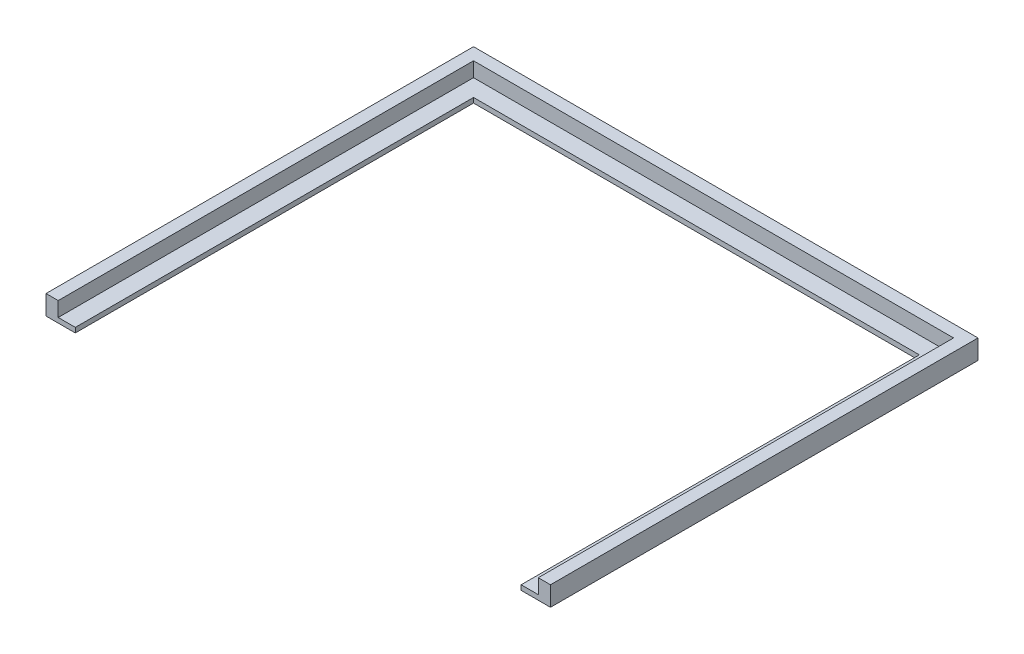
from build123d import *

# Parameters (mm, degrees)
SKETCH1_W               = 206.5
SKETCH1_H               = 350
SKETCH1_W_2             = 182.5
SKETCH1_H_2             = 326
BOSS_EXTRUDE1_DEPTH     = 2
SKETCH2_W               = 206.5
SKETCH2_H               = 350
SKETCH2_W_2             = 196.5
SKETCH2_H_2             = 340
BOSS_EXTRUDE2_DEPTH     = 6
CUT_EXTRUDE3_DEPTH      = 204.345918326
CUT_EXTRUDE3_DEPTH_BACK = 204.345918326
SKETCH3_W               = 400
SKETCH3_H               = 400


with BuildPart() as part:
    # Sketch1 → Boss-Extrude1 (new body)
    with BuildSketch(Plane(origin=(0, 0, 0), x_dir=(1, 0, 0), z_dir=(0, 1, 0))):
        Rectangle(SKETCH1_W, SKETCH1_H)
        Rectangle(SKETCH1_W_2, SKETCH1_H_2, mode=Mode.SUBTRACT)
    extrude(amount=BOSS_EXTRUDE1_DEPTH)

    # Sketch2 → Boss-Extrude2 (add)
    with BuildSketch(Plane(origin=(0, 2, 0), x_dir=(1, 0, 0), z_dir=(0, 1, 0))):
        Rectangle(SKETCH2_W, SKETCH2_H)
        Rectangle(SKETCH2_W_2, SKETCH2_H_2, mode=Mode.SUBTRACT)
    extrude(amount=BOSS_EXTRUDE2_DEPTH)

    # Sketch3 → Cut-Extrude3 (cut, two sides: drawn at the far end of the back side and taken through both)
    with BuildSketch(Plane(origin=(0, 0, 0), x_dir=(1, 0, 0), z_dir=(0, 1, 0)).offset(-CUT_EXTRUDE3_DEPTH_BACK)):
        with Locations((0, -200)):
            Rectangle(SKETCH3_W, SKETCH3_H)
    extrude(amount=CUT_EXTRUDE3_DEPTH + CUT_EXTRUDE3_DEPTH_BACK, mode=Mode.SUBTRACT)


solid = part.part
